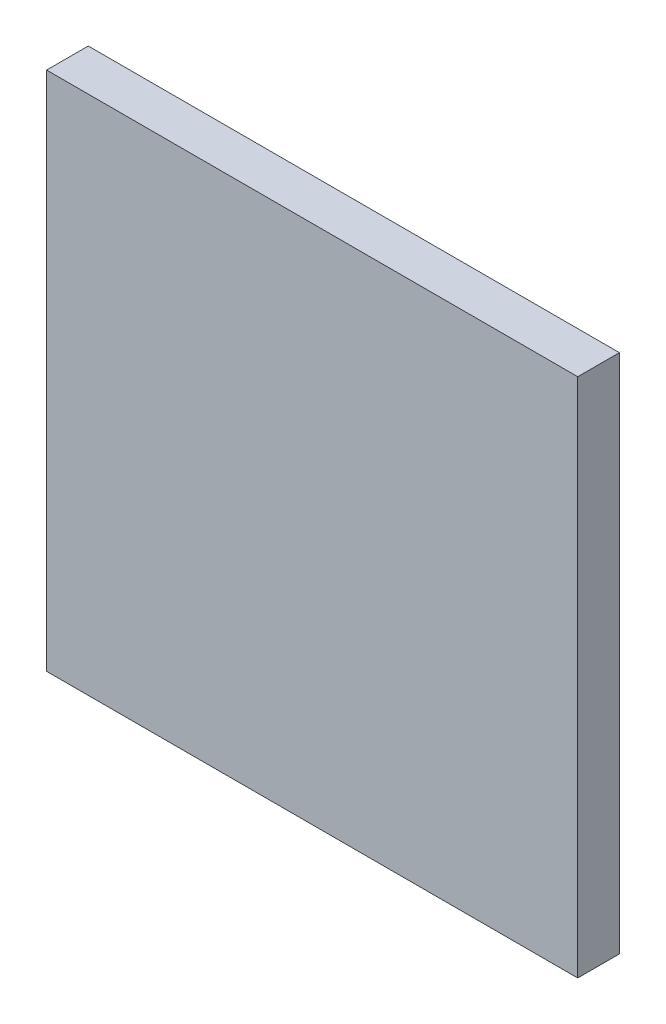
from build123d import *

# Parameters (mm, degrees)
SKETCH1_W           = 255
SKETCH1_H           = 250
BOSS_EXTRUDE1_DEPTH = 20


with BuildPart() as part:
    # Sketch1 → Boss-Extrude1 (new body)
    with BuildSketch(Plane.XY):
        Rectangle(SKETCH1_W, SKETCH1_H)
    extrude(amount=BOSS_EXTRUDE1_DEPTH)


solid = part.part
